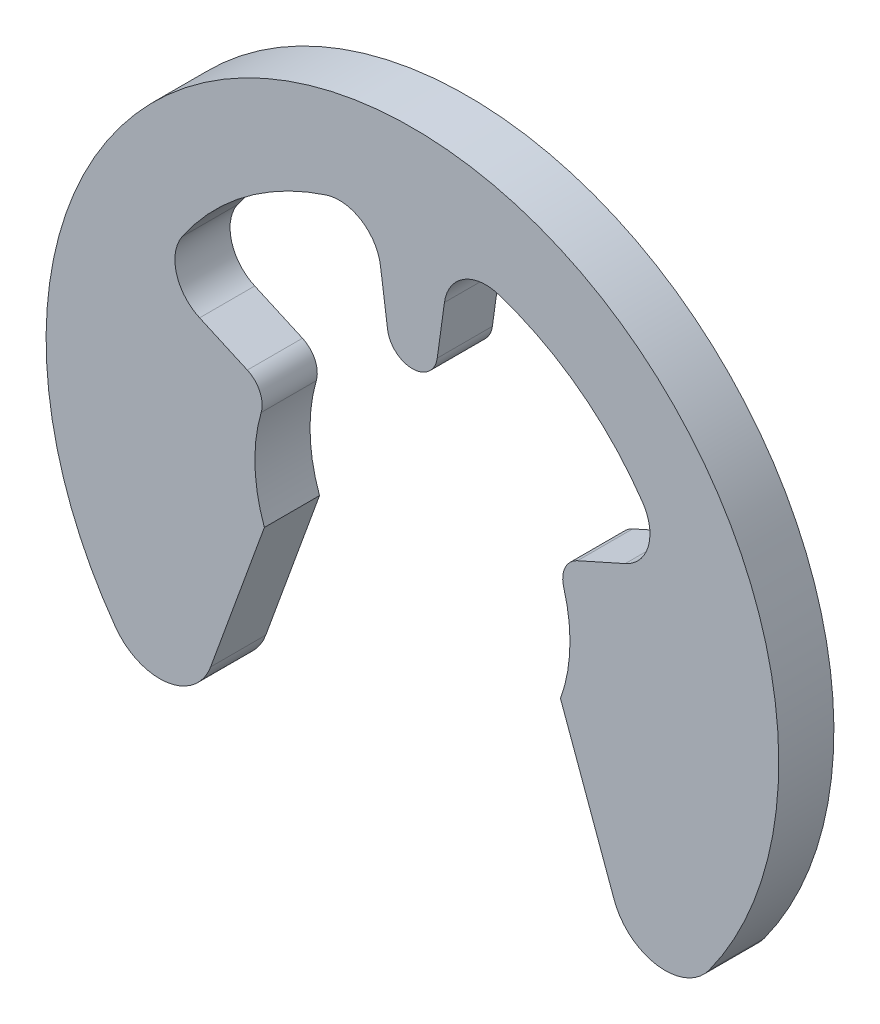
from build123d import *

# Parameters (mm, degrees)
BOSS_EXTRUDE1_DEPTH = 0.7


with BuildPart() as part:
    # Sketch1 → Boss-Extrude1 (new body)
    with BuildSketch(Plane.XY):
        with BuildLine():
            Line((-2.561408424, -2.557883579), (-1.879385242, -0.684040287))
            ThreePointArc((-1.879385242, -0.684040287), (-1.99891759, -0.065791087), (-1.920297211, 0.558979983))
            ThreePointArc((-1.920297211, 0.558979983), (-1.937015688, 0.781382977), (-2.095699977, 0.938105328))
            Line((-2.095699977, 0.938105328), (-2.701605558, 1.209328909))
            ThreePointArc((-2.701605558, 1.209328909), (-2.995016962, 1.548683887), (-2.923070831, 1.991488368))
            ThreePointArc((-2.923070831, 1.991488368), (-2.122951492, 2.829036225), (-1.095155737, 3.363183449))
            ThreePointArc((-1.095155737, 3.363183449), (-0.649889409, 3.308503006), (-0.406063751, 2.931938136))
            Line((-0.406063751, 2.931938136), (-0.314993353, 2.274374461))
            ThreePointArc((-0.314993353, 2.274374461), (0, 2), (0.314993353, 2.274374461))
            Line((0.314993353, 2.274374461), (0.406063751, 2.931938136))
            ThreePointArc((0.406063751, 2.931938136), (0.649889409, 3.308503006), (1.095155737, 3.363183449))
            ThreePointArc((1.095155737, 3.363183449), (2.122951492, 2.829036225), (2.923070831, 1.991488368))
            ThreePointArc((2.923070831, 1.991488368), (2.995016962, 1.548683887), (2.701605558, 1.209328909))
            Line((2.701605558, 1.209328909), (2.095699977, 0.938105328))
            ThreePointArc((2.095699977, 0.938105328), (1.937015688, 0.781382977), (1.920297211, 0.558979983))
            ThreePointArc((1.920297211, 0.558979983), (1.99891759, -0.065791087), (1.879385242, -0.684040287))
            Line((1.879385242, -0.684040287), (2.561408424, -2.557883579))
            ThreePointArc((2.561408424, -2.557883579), (3.113603209, -3.004615598), (3.76702433, -2.726174553))
            ThreePointArc((3.76702433, -2.726174553), (0, 4.65), (-3.76702433, -2.726174553))
            ThreePointArc((-3.76702433, -2.726174553), (-3.113603209, -3.004615598), (-2.561408424, -2.557883579))
        make_face()
    extrude(amount=-BOSS_EXTRUDE1_DEPTH)


solid = part.part
